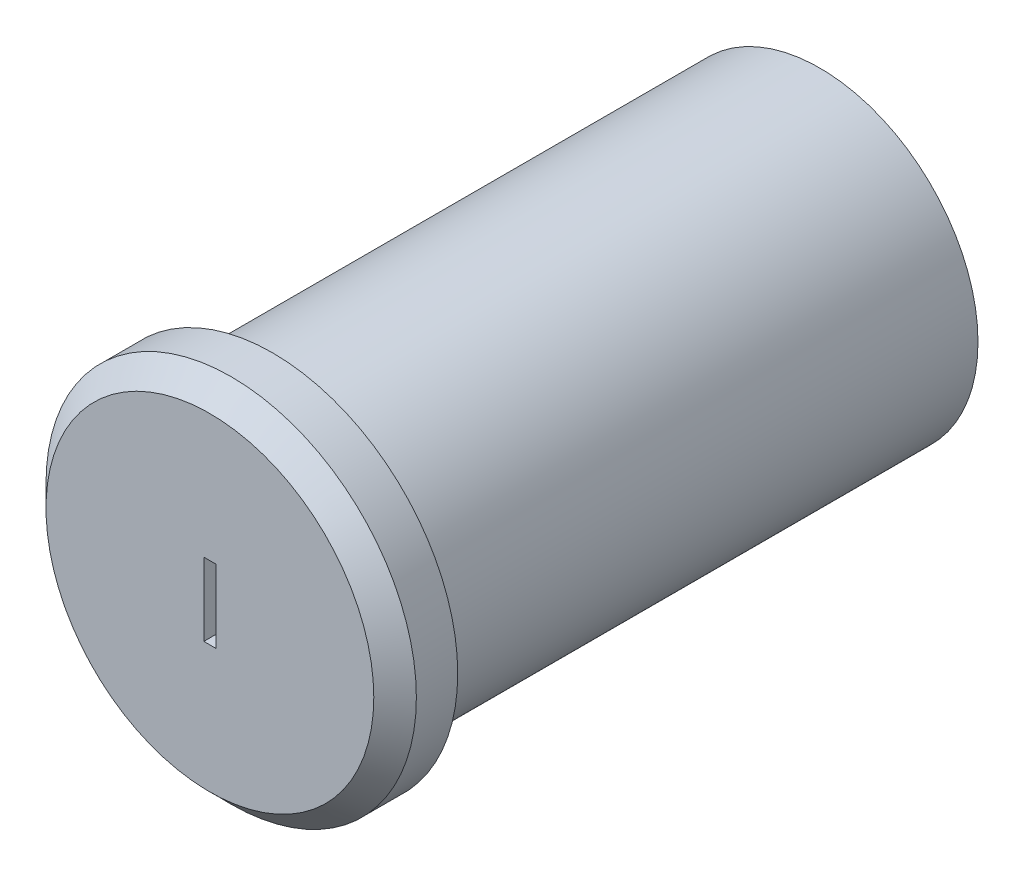
from build123d import *

# Parameters (mm, degrees)
SKETCH1_R           = 13
BOSS_EXTRUDE1_DEPTH = 45
SKETCH2_R           = 15.225
BOSS_EXTRUDE2_DEPTH = 3.4
SKETCH3_R           = 15.225
BOSS_EXTRUDE3_DEPTH = 1.75
BOSS_EXTRUDE3_TAPER = 45
SKETCH4_W           = 1
SKETCH4_H           = 6
CUT_EXTRUDE1_DEPTH  = 1


with BuildPart() as part:
    # Sketch1 → Boss-Extrude1 (new body)
    with BuildSketch(Plane.XY):
        Circle(SKETCH1_R)
    extrude(amount=-BOSS_EXTRUDE1_DEPTH)

    # Sketch2 → Boss-Extrude2 (add)
    with BuildSketch(Plane.XY):
        Circle(SKETCH2_R)
    extrude(amount=BOSS_EXTRUDE2_DEPTH)

    # Sketch3 → Boss-Extrude3 (add)
    with BuildSketch(Plane.XY.offset(3.4)):
        Circle(SKETCH3_R)
    extrude(amount=BOSS_EXTRUDE3_DEPTH, taper=BOSS_EXTRUDE3_TAPER)

    # Sketch4 → Cut-Extrude1 (cut)
    with BuildSketch(Plane.XY.offset(5.15)):
        Rectangle(SKETCH4_W, SKETCH4_H)
    extrude(amount=-CUT_EXTRUDE1_DEPTH, mode=Mode.SUBTRACT)


solid = part.part
